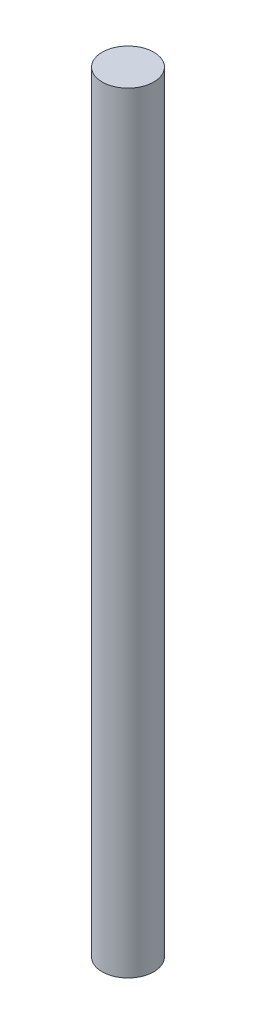
from build123d import *

# Parameters (mm, degrees)
SKETCH_1_R      = 1.4
EXTRUDE_1_DEPTH = 41.8


with BuildPart() as part:
    # 草图1 → 凸台-拉伸1 (new body)
    with BuildSketch(Plane(origin=(0, 0, 0), x_dir=(1, 0, 0), z_dir=(0, 1, 0))):
        with Locations(Location((0, 0, 0), (0, 0, 270))):
            Circle(SKETCH_1_R)
    extrude(amount=EXTRUDE_1_DEPTH)


solid = part.part
